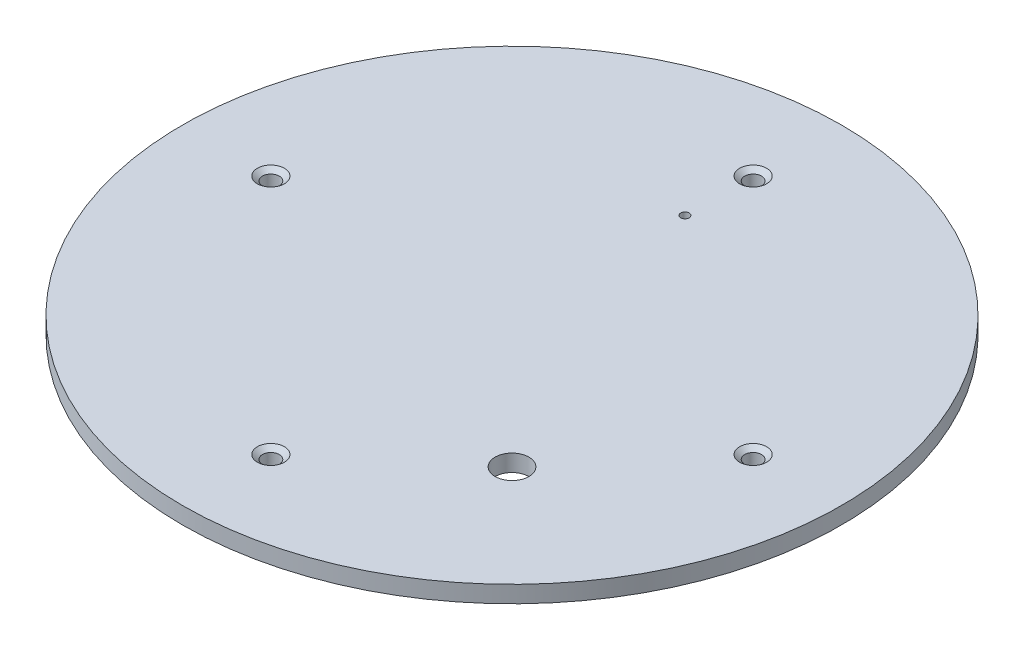
from build123d import *

# Parameters (mm, degrees)
SKETCH1_R                                       = 19.53
BOSS_EXTRUDE1_DEPTH                             = 1
CUT_EXTRUDE1_DEPTH                              = 28.637688036
CUT_EXTRUDE1_DEPTH_BACK                         = 28.637688036
SKETCH6_R                                       = 0.25
SKETCH6_R_2                                     = 1
CSK_FOR_M2_FLAT_HEAD_MACHINE_SCREW1_D           = 1
CSK_FOR_M2_FLAT_HEAD_MACHINE_SCREW1_CSINK_D     = 1.6
CSK_FOR_M2_FLAT_HEAD_MACHINE_SCREW1_CSINK_ANGLE = 100


with BuildPart() as part:
    # Sketch1 → Boss-Extrude1 (new body)
    with BuildSketch(Plane(origin=(0, 0, 0), x_dir=(1, 0, 0), z_dir=(0, 1, 0))):
        with Locations(Location((0, 0, 0), (0, 0, 270))):
            Circle(SKETCH1_R)
    extrude(amount=BOSS_EXTRUDE1_DEPTH)

    # Sketch6 → Cut-Extrude1 (cut, two sides: drawn at the far end of the back side and taken through both)
    with BuildSketch(Plane(origin=(0, 1, 0), x_dir=(1, 0, 0), z_dir=(0, 1, 0)).offset(-CUT_EXTRUDE1_DEPTH_BACK)):
        with Locations(Location((0, 10.25, 0), (0, 0, 270))):
            Circle(SKETCH6_R)
        with Locations(Location((7.778174593, -7.778174593, 0), (0, 0, 270))):
            Circle(SKETCH6_R_2)
    extrude(amount=CUT_EXTRUDE1_DEPTH + CUT_EXTRUDE1_DEPTH_BACK, mode=Mode.SUBTRACT)

    # CSK for M2 Flat Head Machine Screw1 (through all)
    with Locations(Plane(origin=(0, 1, 0), x_dir=(1, 0, 0), z_dir=(0, 1, 0))):
        with Locations((0, 14.29), (-14.29, 0), (0, -14.29), (14.29, 0)):
            CounterSinkHole(CSK_FOR_M2_FLAT_HEAD_MACHINE_SCREW1_D / 2, CSK_FOR_M2_FLAT_HEAD_MACHINE_SCREW1_CSINK_D / 2, counter_sink_angle=CSK_FOR_M2_FLAT_HEAD_MACHINE_SCREW1_CSINK_ANGLE)


solid = part.part
